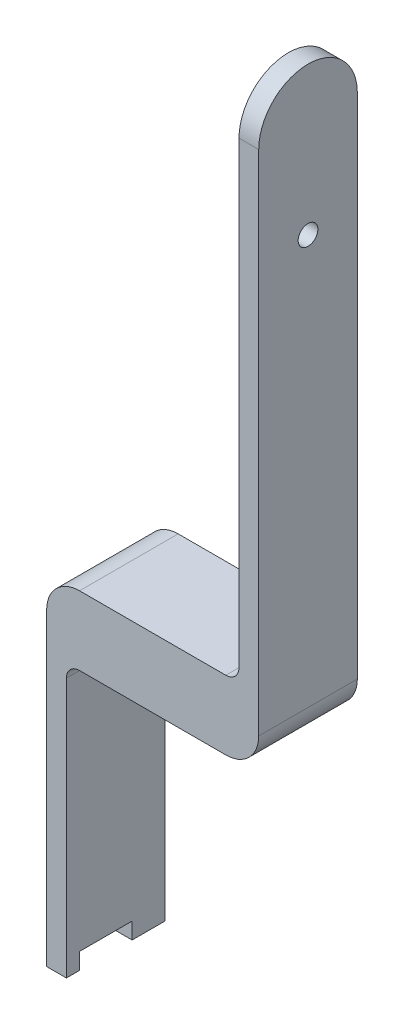
from build123d import *

# Parameters (mm, degrees)
BOSS_EXTRUDE1_DEPTH          = 32.251106428
SKETCH2_W                    = 29.251106428
SKETCH2_H                    = 41.502212856
CUT_EXTRUDE1_DEPTH           = 107.913538909
SKETCH3_W                    = 29.251106428
SKETCH3_H                    = 79.251106428
CUT_EXTRUDE2_DEPTH           = 107.913538909
SKETCH4_W                    = 8
SKETCH4_H                    = 2.5
CUT_EXTRUDE3_DEPTH           = 116.523199892
F_3_0_3_DIAMETER_HOLE1_D     = 3
F_3_0_3_DIAMETER_HOLE1_DEPTH = 32.251106428
FILLET1_R                    = 2
FILLET2_R                    = 5


with BuildPart() as part:
    # Sketch1 → Boss-Extrude1 (new body)
    with BuildSketch(Plane(origin=(-23.875925357, 0, 0), x_dir=(0, 0, -1), z_dir=(1, 0, 0))):
        with BuildLine():
            Line((-65.19367103, 82.251106428), (-65.19367103, -41.502212856))
            Line((-65.19367103, -41.502212856), (-50.19367103, -41.502212856))
            Line((-50.19367103, -41.502212856), (-50.19367103, 82.251106428))
            ThreePointArc((-50.19367103, 82.251106428), (-57.69367103, 89.751106428), (-65.19367103, 82.251106428))
        make_face()
    extrude(amount=-BOSS_EXTRUDE1_DEPTH)

    # Sketch2 → Cut-Extrude1 (cut, through all)
    with BuildSketch(Plane.XY.offset(65.19367103)):
        with Locations((-38.501478571, -20.751106428)):
            Rectangle(SKETCH2_W, SKETCH2_H)
    extrude(amount=-CUT_EXTRUDE1_DEPTH, mode=Mode.SUBTRACT)

    # Sketch3 → Cut-Extrude2 (cut, through all)
    with BuildSketch(Plane.XY.offset(65.19367103)):
        with Locations((-41.501478571, 50.125553214)):
            Rectangle(SKETCH3_W, SKETCH3_H)
    extrude(amount=-CUT_EXTRUDE2_DEPTH, mode=Mode.SUBTRACT)

    # Sketch4 → Cut-Extrude3 (cut, through all)
    with BuildSketch(Plane.ZY.offset(56.127031785)):
        with Locations((59.19367103, -40.252212856)):
            Rectangle(SKETCH4_W, SKETCH4_H)
    extrude(amount=-CUT_EXTRUDE3_DEPTH, mode=Mode.SUBTRACT)

    # Ø3.0 (3) Diameter Hole1
    with Locations(Plane(origin=(-23.875925357, 0, 0), x_dir=(0, 0, -1), z_dir=(1, 0, 0))):
        with Locations((-57.69367103, 67.251106428)):
            Hole(F_3_0_3_DIAMETER_HOLE1_D / 2, depth=F_3_0_3_DIAMETER_HOLE1_DEPTH)

    # Fillet1
    fillet1_edges = [part.edges().sort_by_distance(p)[0] for p in [
        (-53.127031785, 0, 57.69367103),
        (-26.875925357, 10.5, 57.69367103),
    ]]
    fillet(fillet1_edges, radius=FILLET1_R)

    # Fillet2
    fillet2_edges = [part.edges().sort_by_distance(p)[0] for p in [
        (-23.875925357, 0, 57.69367103),
        (-56.127031785, 10.5, 57.69367103),
    ]]
    fillet(fillet2_edges, radius=FILLET2_R)


solid = part.part
